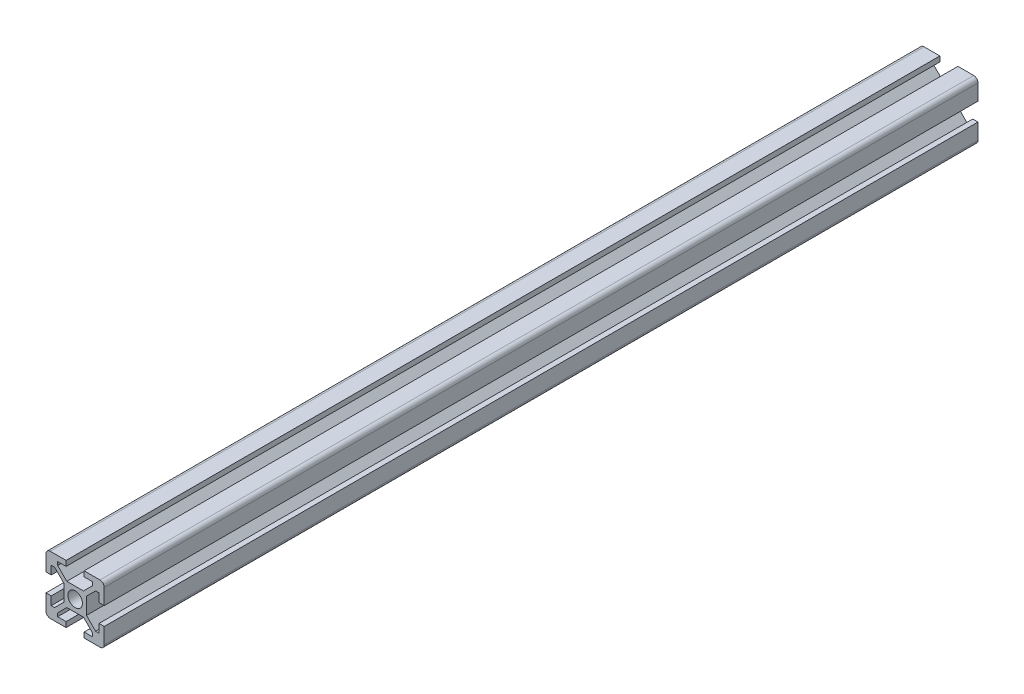
from build123d import *

# Parameters (mm, degrees)
SKETCH1_R           = 2.5
BOSS_EXTRUDE1_DEPTH = 300
FILLET1_R           = 1.47
SKETCH2_R           = 1.5
CUT_EXTRUDE1_DEPTH  = 301.488285961
SKETCH3_R           = 1.5
CUT_EXTRUDE2_DEPTH  = 301.488286061
SKETCH4_R           = 1.5
CUT_EXTRUDE3_DEPTH  = 301.488286061


with BuildPart() as part:
    # Sketch1 → Boss-Extrude1 (new body)
    with BuildSketch(Plane.XY):
        Polygon((2.860553032, 3.9), (6, 7.039446968), (6, 8.2), (3.1, 8.2), (3.1, 10), (10, 10), (10, 3.1), (8.2, 3.1), (8.2, 6), (7.039446968, 6), (3.9, 2.860553032), (3.9, 0), (3.9, -2.860553032), (7.039446968, -6), (8.2, -6), (8.2, -3.1), (10, -3.1), (10, -10), (3.1, -10), (3.1, -8.2), (6, -8.2), (6, -7.039446968), (2.860553032, -3.9), (0, -3.9), (-2.860553032, -3.9), (-6, -7.039446968), (-6, -8.2), (-3.1, -8.2), (-3.1, -10), (-10, -10), (-10, -3.1), (-8.2, -3.1), (-8.2, -6), (-7.039446968, -6), (-3.9, -2.860553032), (-3.9, 0), (-3.9, 2.860553032), (-7.039446968, 6), (-8.2, 6), (-8.2, 3.1), (-10, 3.1), (-10, 10), (-3.1, 10), (-3.1, 8.2), (-6, 8.2), (-6, 7.039446968), (-2.860553032, 3.9), (0, 3.9), align=None)
        Circle(SKETCH1_R, mode=Mode.SUBTRACT)
    extrude(amount=BOSS_EXTRUDE1_DEPTH)

    # Fillet1
    fillet1_edges = [part.edges().sort_by_distance(p)[0] for p in [
        (10, -10, 150),
        (-10, -10, 150),
        (-10, 10, 150),
        (10, 10, 150),
    ]]
    fillet(fillet1_edges, radius=FILLET1_R)

    # Sketch2 → Cut-Extrude1 (cut, through all)
    with BuildSketch(Plane(origin=(3.9, 0, 0), x_dir=(0, 0, -1), z_dir=(1, 0, 0))):
        with Locations(Location((-150, 0, 0), (0, 0, 90))):
            Circle(SKETCH2_R)
    extrude(amount=-CUT_EXTRUDE1_DEPTH, mode=Mode.SUBTRACT)

    # Sketch3 → Cut-Extrude2 (cut, through all)
    with BuildSketch(Plane(origin=(3.9, 0, 0), x_dir=(0, 0, -1), z_dir=(1, 0, 0))):
        with Locations(Location((-77.5, 0, 0), (0, 0, 90))):
            Circle(SKETCH3_R)
    extrude(amount=-CUT_EXTRUDE2_DEPTH, mode=Mode.SUBTRACT)

    # Sketch4 → Cut-Extrude3 (cut, through all)
    with BuildSketch(Plane(origin=(0, 3.9, 0), x_dir=(1, 0, 0), z_dir=(0, 1, 0))):
        with Locations(Location((0, -50, 0), (0, 0, 180))):
            Circle(SKETCH4_R)
        with Locations(Location((0, -250, 0), (0, 0, 180))):
            Circle(SKETCH4_R)
    extrude(amount=-CUT_EXTRUDE3_DEPTH, mode=Mode.SUBTRACT)


solid = part.part
